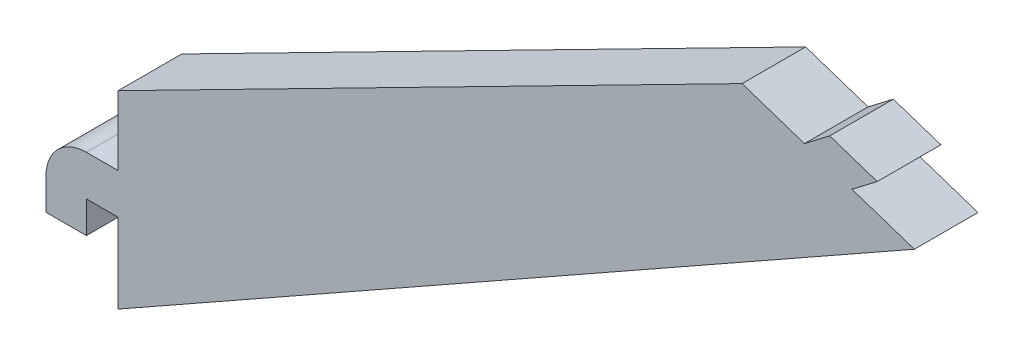
from build123d import *

# Parameters (mm, degrees)
BOSS_EXTRUDE1_DEPTH = 6.35


with BuildPart() as part:
    # Sketch2 → Boss-Extrude1 (new body)
    with BuildSketch(Plane.XY):
        with BuildLine():
            Line((-0.14988496, 38.540888918), (6.080919163, 36.469296285))
            Line((6.080919163, 36.469296285), (8.602283556, 38.398893807))
            Line((8.602283556, 38.398893807), (13.346918999, 36.821416544))
            Line((13.346918999, 36.821416544), (10.825554606, 34.891819022))
            Line((10.825554606, 34.891819022), (17.056358729, 32.820226388))
            Line((17.056358729, 32.820226388), (-62.447694199, -12.10770477))
            Line((-62.447694199, -12.10770477), (-62.447694199, -4.16341339))
            Line((-62.447694199, -4.16341339), (-65.622694199, -4.16341339))
            Line((-65.622694199, -4.16341339), (-65.622694199, -7.33841339))
            Line((-65.622694199, -7.33841339), (-69.654994999, -7.33841339))
            Line((-69.654994999, -7.33841339), (-69.654994999, -4.16341339))
            ThreePointArc((-69.654994999, -4.16341339), (-68.473961439, -1.312146151), (-65.622694199, -0.13111259))
            Line((-65.622694199, -0.13111259), (-62.447694199, -0.13111259))
            Line((-62.447694199, -0.13111259), (-62.447694199, 6.780877989))
            Line((-62.447694199, 6.780877989), (-0.14988496, 38.540888918))
        make_face()
    extrude(amount=BOSS_EXTRUDE1_DEPTH)


solid = part.part
